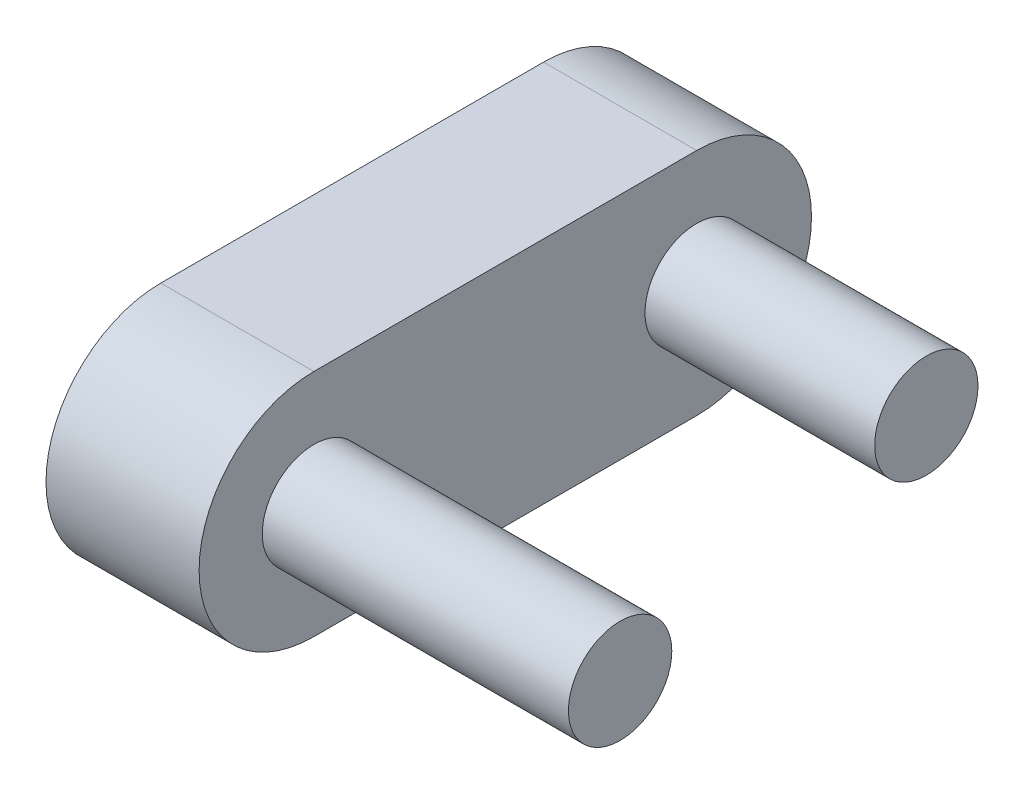
from build123d import *

# Parameters (mm, degrees)
BOSS_EXTRUDE1_DEPTH = 1
SKETCH2_R           = 0.675
BOSS_EXTRUDE2_DEPTH = 5
SKETCH3_R           = 0.675
BOSS_EXTRUDE3_DEPTH = 4


with BuildPart() as part:
    # Sketch1 → Boss-Extrude1 (new, symmetric)
    with BuildSketch(Plane(origin=(0, 0, 0), x_dir=(0, 0, -1), z_dir=(1, 0, 0))):
        with BuildLine():
            Line((-2.5, 1.5), (2.5, 1.5))
            ThreePointArc((2.5, 1.5), (4, 0), (2.5, -1.5))
            Line((2.5, -1.5), (-2.5, -1.5))
            ThreePointArc((-2.5, -1.5), (-4, 0), (-2.5, 1.5))
        make_face()
    extrude(amount=BOSS_EXTRUDE1_DEPTH, both=True)

    # Sketch2 → Boss-Extrude2 (add)
    with BuildSketch(Plane(origin=(0, 0, 0), x_dir=(0, 0, -1), z_dir=(1, 0, 0))):
        with Locations((-2.5, 0)):
            Circle(SKETCH2_R)
    extrude(amount=BOSS_EXTRUDE2_DEPTH)

    # Sketch3 → Boss-Extrude3 (add)
    with BuildSketch(Plane(origin=(0, 0, 0), x_dir=(0, 0, -1), z_dir=(1, 0, 0))):
        with Locations((2.5, 0)):
            Circle(SKETCH3_R)
    extrude(amount=BOSS_EXTRUDE3_DEPTH)


solid = part.part
